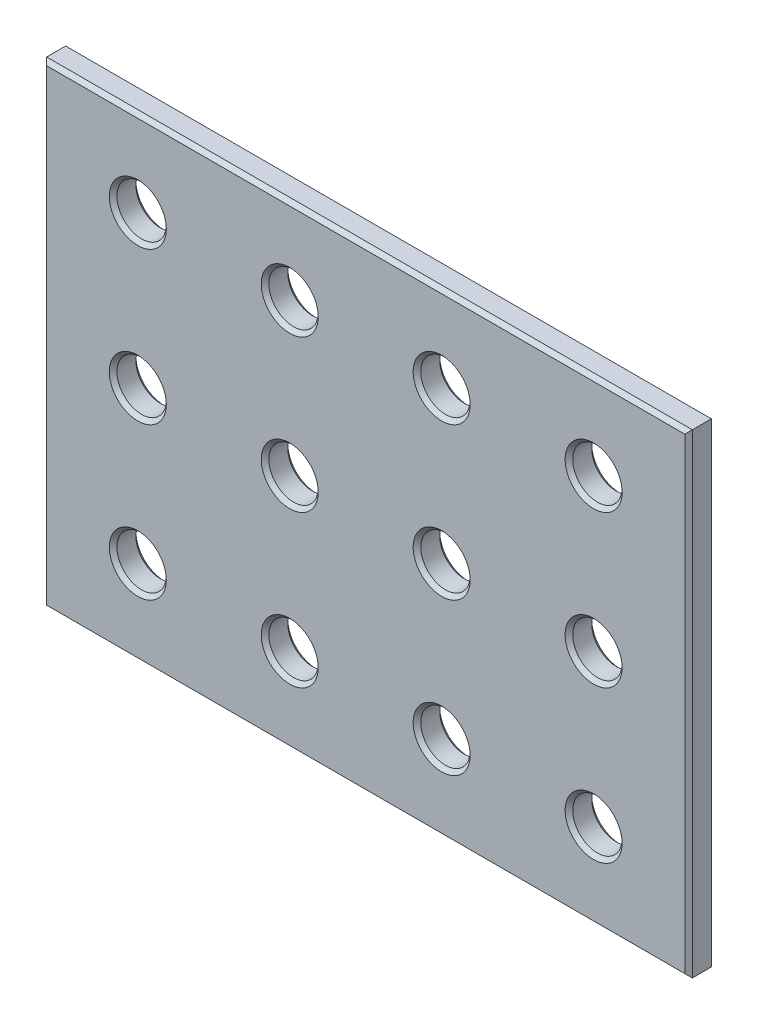
from build123d import *

# Parameters (mm, degrees)
SKETCH_1_W        = 340
SKETCH_1_H        = 250
SKETCH_1_R        = 13
EXTRUDE_406_DEPTH = 14
CHAMFER_1_SIZE    = 2


with BuildPart() as part:
    # 草图1 → Extrude 406 (new body)
    with BuildSketch(Plane.XY):
        Rectangle(SKETCH_1_W, SKETCH_1_H)
        with Locations((-120, 80)):
            Circle(SKETCH_1_R, mode=Mode.SUBTRACT)
        with Locations((-40, 80)):
            Circle(SKETCH_1_R, mode=Mode.SUBTRACT)
        with Locations((-40, 0)):
            Circle(SKETCH_1_R, mode=Mode.SUBTRACT)
        with Locations((-120, 0)):
            Circle(SKETCH_1_R, mode=Mode.SUBTRACT)
        with Locations(Location((-40, -80, 0), (0, 0, 180))):
            Circle(SKETCH_1_R, mode=Mode.SUBTRACT)
        with Locations(Location((-120, -80, 0), (0, 0, 180))):
            Circle(SKETCH_1_R, mode=Mode.SUBTRACT)
        with Locations((120, -80)):
            Circle(SKETCH_1_R, mode=Mode.SUBTRACT)
        with Locations((40, -80)):
            Circle(SKETCH_1_R, mode=Mode.SUBTRACT)
        with Locations(Location((120, 0, 0), (0, 0, 180))):
            Circle(SKETCH_1_R, mode=Mode.SUBTRACT)
        with Locations(Location((40, 0, 0), (0, 0, 180))):
            Circle(SKETCH_1_R, mode=Mode.SUBTRACT)
        with Locations(Location((40, 80, 0), (0, 0, 180))):
            Circle(SKETCH_1_R, mode=Mode.SUBTRACT)
        with Locations(Location((120, 80, 0), (0, 0, 180))):
            Circle(SKETCH_1_R, mode=Mode.SUBTRACT)
    extrude(amount=EXTRUDE_406_DEPTH)

    # 倒角1
    chamfer_1_edges = [part.edges().sort_by_distance(p)[0] for p in [
        (170, 0, 14),
        (-133, 80, 0),
        (-133, 80, 14),
        (0, 125, 14),
        (-53, 80, 0),
        (-53, 80, 14),
        (-53, 0, 0),
        (-53, 0, 14),
        (-133, 0, 0),
        (-133, 0, 14),
        (-27, -80, 0),
        (-27, -80, 14),
        (-107, -80, 0),
        (-107, -80, 14),
        (107, -80, 0),
        (107, -80, 14),
        (27, -80, 0),
        (27, -80, 14),
        (-170, 0, 14),
        (133, 0, 0),
        (133, 0, 14),
        (0, 125, 0),
        (53, 0, 0),
        (53, 0, 14),
        (170, 0, 0),
        (53, 80, 0),
        (53, 80, 14),
        (0, -125, 0),
        (133, 80, 0),
        (133, 80, 14),
        (-170, 0, 0),
        (0, -125, 14),
    ]]
    chamfer(chamfer_1_edges, length=CHAMFER_1_SIZE)


solid = part.part
